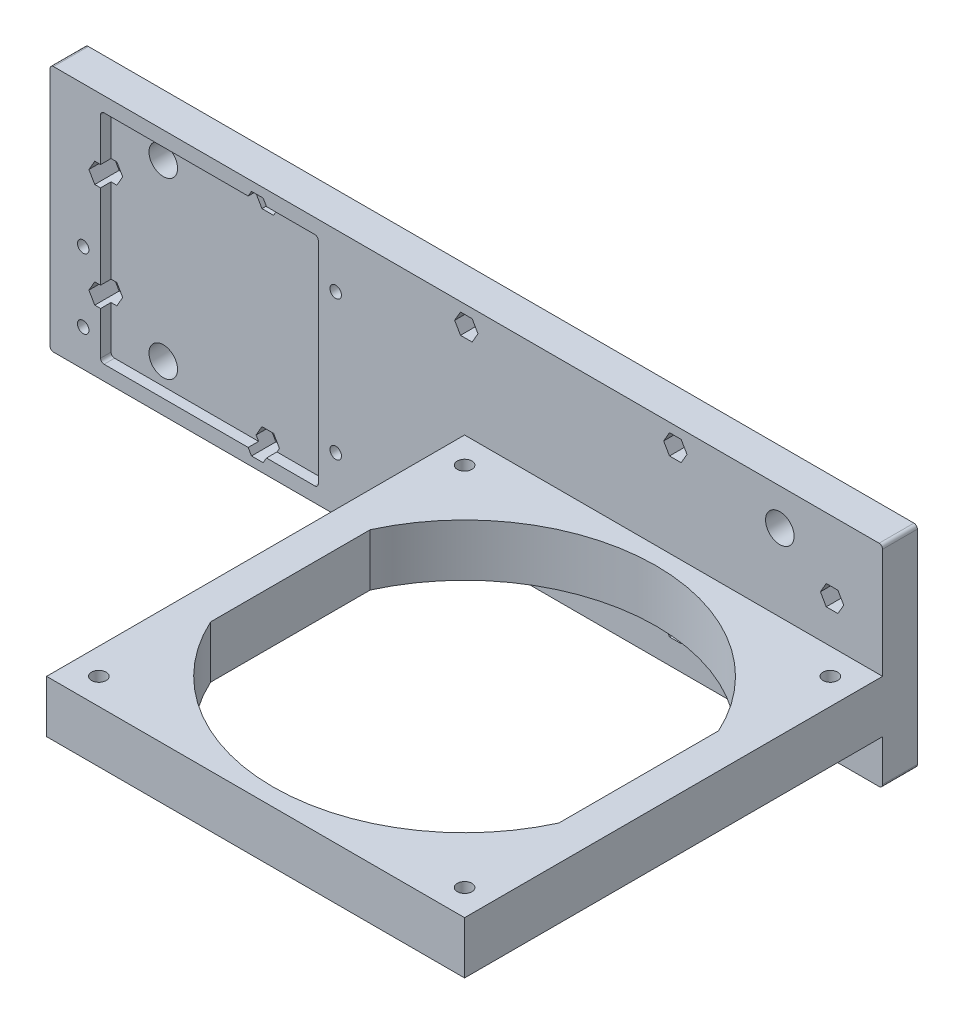
from build123d import *

# Parameters (mm, degrees)
SKETCH1_R           = 4.1
SKETCH1_R_2         = 1.65
BOSS_EXTRUDE1_DEPTH = 10
CUT_EXTRUDE1_DEPTH  = 7
CUT_EXTRUDE2_DEPTH  = 3
CUT_EXTRUDE3_DEPTH  = 5
SKETCH5_W           = 120
SKETCH5_H           = 15
BOSS_EXTRUDE2_DEPTH = 120
SKETCH6_R           = 2.1
CUT_EXTRUDE4_DEPTH  = 15


with BuildPart() as part:
    # Sketch1 → Boss-Extrude1 (new body)
    with BuildSketch(Plane.XY):
        with BuildLine():
            Line((118.5, -25), (95.0009999, -25))
            ThreePointArc((95.0009999, -25), (94.366996127, -24.773329953), (94.020411684, -24.196078431))
            ThreePointArc((94.020411684, -24.196078431), (90, -20.9), (85.979588316, -24.196078431))
            ThreePointArc((85.979588316, -24.196078431), (85.633003873, -24.773329953), (84.9990001, -25))
            Line((84.9990001, -25), (-14, -25))
            ThreePointArc((-14, -25), (-14.707106781, -25.292893219), (-15, -26))
            Line((-15, -26), (-15, -34.5))
            ThreePointArc((-15, -34.5), (-15.292893219, -35.207106781), (-16, -35.5))
            Line((-16, -35.5), (-118.5, -35.5))
            ThreePointArc((-118.5, -35.5), (-119.207106781, -35.207106781), (-119.5, -34.5))
            Line((-119.5, -34.5), (-119.5, 34.5))
            ThreePointArc((-119.5, 34.5), (-119.207106781, 35.207106781), (-118.5, 35.5))
            Line((-118.5, 35.5), (118.5, 35.5))
            ThreePointArc((118.5, 35.5), (119.207106781, 35.207106781), (119.5, 34.5))
            Line((119.5, 34.5), (119.5, -24))
            ThreePointArc((119.5, -24), (119.207106781, -24.707106781), (118.5, -25))
        make_face()
        with Locations((-90, 25)):
            Circle(SKETCH1_R, mode=Mode.SUBTRACT)
        with Locations((90, 25)):
            Circle(SKETCH1_R, mode=Mode.SUBTRACT)
        with Locations((-90, -25)):
            Circle(SKETCH1_R, mode=Mode.SUBTRACT)
        with Locations((105, -15)):
            Circle(SKETCH1_R_2, mode=Mode.SUBTRACT)
        with Locations((-60, 30)):
            Circle(SKETCH1_R_2, mode=Mode.SUBTRACT)
        with Locations((-60, -30)):
            Circle(SKETCH1_R_2, mode=Mode.SUBTRACT)
        with Locations((-105, 15)):
            Circle(SKETCH1_R_2, mode=Mode.SUBTRACT)
        with Locations((-105, -15)):
            Circle(SKETCH1_R_2, mode=Mode.SUBTRACT)
        with Locations(Location((-37.5, 20, 0), (0, 0, 180))):
            Circle(SKETCH1_R_2, mode=Mode.SUBTRACT)
        with Locations(Location((-37.5, -20, 0), (0, 0, 180))):
            Circle(SKETCH1_R_2, mode=Mode.SUBTRACT)
        with Locations(Location((-110, -5.001676566, 0), (0, 0, 180))):
            Circle(SKETCH1_R_2, mode=Mode.SUBTRACT)
        with Locations(Location((-110, -25, 0), (0, 0, 180))):
            Circle(SKETCH1_R_2, mode=Mode.SUBTRACT)
        with Locations((60, 30)):
            Circle(SKETCH1_R_2, mode=Mode.SUBTRACT)
        with Locations((60, -15)):
            Circle(SKETCH1_R_2, mode=Mode.SUBTRACT)
        with Locations((105, 15)):
            Circle(SKETCH1_R_2, mode=Mode.SUBTRACT)
        with Locations((0, 30)):
            Circle(SKETCH1_R_2, mode=Mode.SUBTRACT)
        with Locations((0, -15)):
            Circle(SKETCH1_R_2, mode=Mode.SUBTRACT)
    extrude(amount=BOSS_EXTRUDE1_DEPTH)

    # Sketch2 → Cut-Extrude1 (cut)
    with BuildSketch(Plane.XY.offset(10)):
        Polygon((-101.651368439, 15), (-103.325684219, 17.9), (-106.674315781, 17.9), (-108.348631561, 15), (-106.674315781, 12.1), (-103.325684219, 12.1), align=None)
        Polygon((-101.651368439, -15), (-103.325684219, -12.1), (-106.674315781, -12.1), (-108.348631561, -15), (-106.674315781, -17.9), (-103.325684219, -17.9), align=None)
        Polygon((-56.651368439, 30), (-58.325684219, 32.9), (-61.674315781, 32.9), (-63.348631561, 30), (-61.674315781, 27.1), (-58.325684219, 27.1), align=None)
        Polygon((108.348631561, -15), (106.674315781, -12.1), (103.325684219, -12.1), (101.651368439, -15), (103.325684219, -17.9), (106.674315781, -17.9), align=None)
        Polygon((63.348631561, 30), (61.674315781, 32.9), (58.325684219, 32.9), (56.651368439, 30), (58.325684219, 27.1), (61.674315781, 27.1), align=None)
        Polygon((-56.651368439, -30), (-58.325684219, -27.1), (-61.674315781, -27.1), (-63.348631561, -30), (-61.674315781, -32.9), (-58.325684219, -32.9), align=None)
        Polygon((63.348631561, -15), (61.674315781, -12.1), (58.325684219, -12.1), (56.651368439, -15), (58.325684219, -17.9), (61.674315781, -17.9), align=None)
        Polygon((108.348631561, 15), (106.674315781, 17.9), (103.325684219, 17.9), (101.651368439, 15), (103.325684219, 12.1), (106.674315781, 12.1), align=None)
        Polygon((3.348631561, 30), (1.674315781, 32.9), (-1.674315781, 32.9), (-3.348631561, 30), (-1.674315781, 27.1), (1.674315781, 27.1), align=None)
        Polygon((3.348631561, -15), (1.674315781, -12.1), (-1.674315781, -12.1), (-3.348631561, -15), (-1.674315781, -17.9), (1.674315781, -17.9), align=None)
    extrude(amount=-CUT_EXTRUDE1_DEPTH, mode=Mode.SUBTRACT)

    # Sketch3 → Cut-Extrude2 (cut)
    with BuildSketch(Plane.XY.offset(10)):
        with BuildLine():
            Line((-104, 31.25), (-43.5, 31.25))
            ThreePointArc((-43.5, 31.25), (-42.792893219, 30.957106781), (-42.5, 30.25))
            Line((-42.5, 30.25), (-42.5, -30.25))
            ThreePointArc((-42.5, -30.25), (-42.792893219, -30.957106781), (-43.5, -31.25))
            Line((-43.5, -31.25), (-104, -31.25))
            ThreePointArc((-104, -31.25), (-104.707106781, -30.957106781), (-105, -30.25))
            Line((-105, -30.25), (-105, 30.25))
            ThreePointArc((-105, 30.25), (-104.707106781, 30.957106781), (-104, 31.25))
        make_face()
    extrude(amount=-CUT_EXTRUDE2_DEPTH, mode=Mode.SUBTRACT)

    # Sketch4 → Cut-Extrude3 (cut)
    with BuildSketch(Plane(origin=(0, 0, 0), x_dir=(-1, 0, 0), z_dir=(0, 0, -1))):
        Polygon((40.848631561, 20), (39.174315781, 22.9), (35.825684219, 22.9), (34.151368439, 20), (35.825684219, 17.1), (39.174315781, 17.1), align=None)
        Polygon((40.848631561, -20), (39.174315781, -17.1), (35.825684219, -17.1), (34.151368439, -20), (35.825684219, -22.9), (39.174315781, -22.9), align=None)
        Polygon((113.348631561, -25), (111.674315781, -22.1), (108.325684219, -22.1), (106.651368439, -25), (108.325684219, -27.9), (111.674315781, -27.9), align=None)
        Polygon((113.348631561, -5.001676566), (111.674315781, -2.101676566), (108.325684219, -2.101676566), (106.651368439, -5.001676566), (108.325684219, -7.901676566), (111.674315781, -7.901676566), align=None)
    extrude(amount=-CUT_EXTRUDE3_DEPTH, mode=Mode.SUBTRACT)

    # Sketch5 → Boss-Extrude2 (add)
    with BuildSketch(Plane.XY.offset(10)):
        with Locations((59.5, -4.6)):
            Rectangle(SKETCH5_W, SKETCH5_H)
    extrude(amount=BOSS_EXTRUDE2_DEPTH)

    # Sketch6 → Cut-Extrude4 (cut)
    with BuildSketch(Plane.XZ.offset(12.1)):
        with Locations(Location((7, 122.5, 0), (0, 0, 270))):
            Circle(SKETCH6_R)
        with Locations(Location((7, 17.5, 0), (0, 0, 270))):
            Circle(SKETCH6_R)
        with Locations(Location((112, 17.5, 0), (0, 0, 270))):
            Circle(SKETCH6_R)
        with Locations(Location((112, 122.5, 0), (0, 0, 270))):
            Circle(SKETCH6_R)
        with BuildLine():
            Line((9.5, 92.912878475), (9.5, 47.087121525))
            ThreePointArc((9.5, 47.087121525), (59.5, 15), (109.5, 47.087121525))
            Line((109.5, 47.087121525), (109.5, 92.912878475))
            ThreePointArc((109.5, 92.912878475), (59.5, 125), (9.5, 92.912878475))
        make_face()
    extrude(amount=-CUT_EXTRUDE4_DEPTH, mode=Mode.SUBTRACT)


solid = part.part
